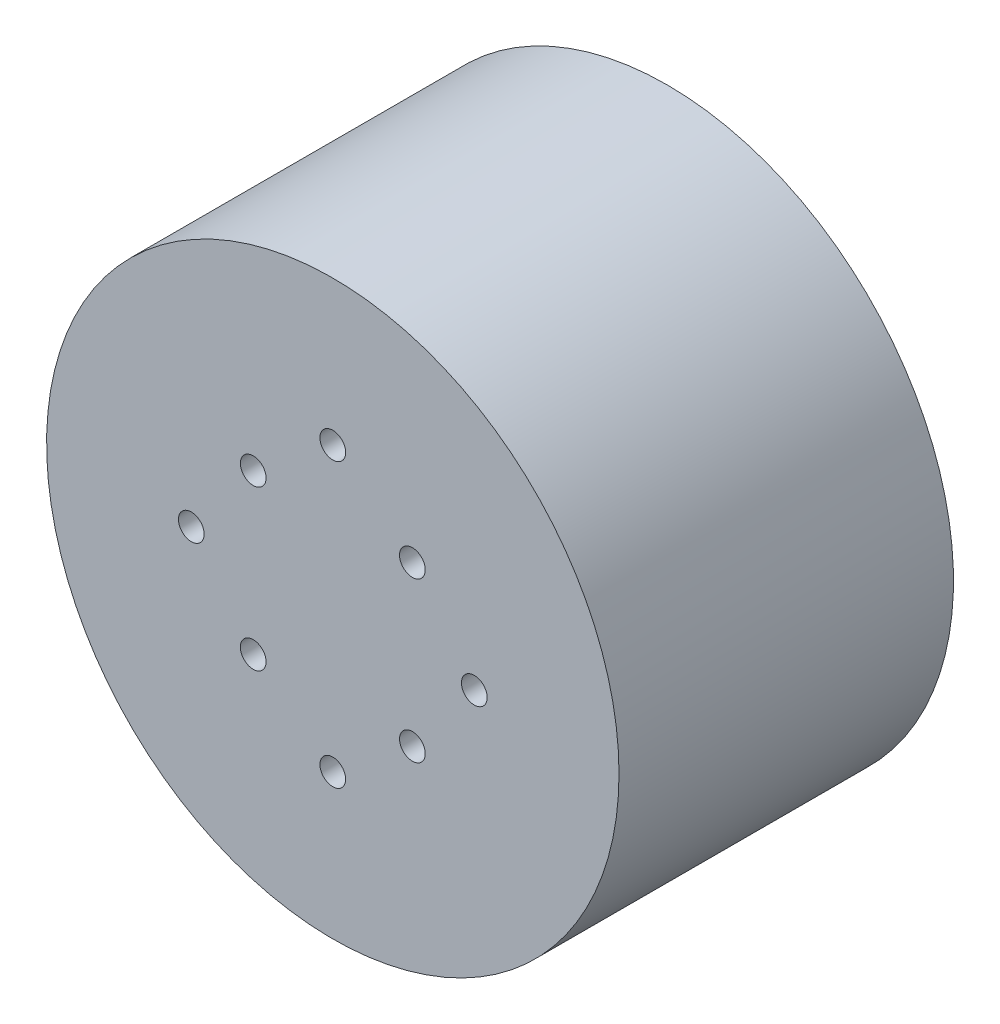
from build123d import *

# Parameters (mm, degrees)
SKETCH_1_R               = 44.5
EXTRUDE_1_DEPTH          = 52
HOLE_WIZARD_M4_1_D       = 3.3
HOLE_WIZARD_M4_1_DEPTH   = 12
HOLE_WIZARD_M4_1_TIP     = 0.991420021
SKETCH_4_R               = 2
CUT_EXTRUDE_1_DEPTH      = 10
PATTERN_CIRCULAR_1_COUNT = 4
SKETCH_5_W               = 19.478252765
SKETCH_5_H               = 48.547320344
CUT_EXTRUDE_2_DEPTH      = 10
SKETCH_6_W               = 5.245291094
SKETCH_6_H               = 29.052548629
CUT_EXTRUDE_3_DEPTH      = 10


with BuildPart() as part:
    # 草图1 → 凸台-拉伸1 (new body)
    with BuildSketch(Plane.XY):
        with Locations(Location((0, 0, 0), (0, 0, 180))):
            Circle(SKETCH_1_R)
    extrude(amount=EXTRUDE_1_DEPTH)

    # M4 螺纹孔的螺纹孔钻头1
    with Locations(Plane(origin=(15, 15, 0), x_dir=(-1, 0, 0), z_dir=(0, 0, -1))):
        with Locations((0, 0), (30, 0), (30, -30), (0, -30)):
            Hole(HOLE_WIZARD_M4_1_D / 2, depth=HOLE_WIZARD_M4_1_DEPTH)
            with Locations((0, 0, -(HOLE_WIZARD_M4_1_DEPTH + HOLE_WIZARD_M4_1_TIP / 2))):  # 118° drill point
                Cone(0, HOLE_WIZARD_M4_1_D / 2, HOLE_WIZARD_M4_1_TIP, mode=Mode.SUBTRACT)

    # 草图4 → 切除-拉伸1 (cut)
    with BuildSketch(Plane.XY.offset(52)):
        with Locations((0, 22)):
            Circle(SKETCH_4_R)
        with Locations((12.374368671, 12.374368671)):
            Circle(SKETCH_4_R)
    cut_extrude_1 = extrude(amount=-CUT_EXTRUDE_1_DEPTH, mode=Mode.SUBTRACT)

    # 阵列(圆周)1: 切除-拉伸1 ×4 about axis
    pattern_circular_1_axis = Axis((0, 0, 0), (0, 0, 1))
    for i in range(1, PATTERN_CIRCULAR_1_COUNT):
        add(cut_extrude_1.rotate(pattern_circular_1_axis, i * 360 / PATTERN_CIRCULAR_1_COUNT), mode=Mode.SUBTRACT)

    # 草图5 → 切除-拉伸2 (cut)
    with BuildSketch(Plane(origin=(0, 0, 0), x_dir=(-1, 0, 0), z_dir=(0, 0, -1))):
        with Locations((48.243799035, -1.742903496)):
            Rectangle(SKETCH_5_W, SKETCH_5_H)
    extrude(amount=-CUT_EXTRUDE_2_DEPTH, mode=Mode.SUBTRACT)

    # 草图6 → 切除-拉伸3 (cut)
    with BuildSketch(Plane.ZY.offset(38.504672652)):
        with Locations((5.335468617, -0.326949721)):
            Rectangle(SKETCH_6_W, SKETCH_6_H)
    extrude(amount=-CUT_EXTRUDE_3_DEPTH, mode=Mode.SUBTRACT)


solid = part.part
